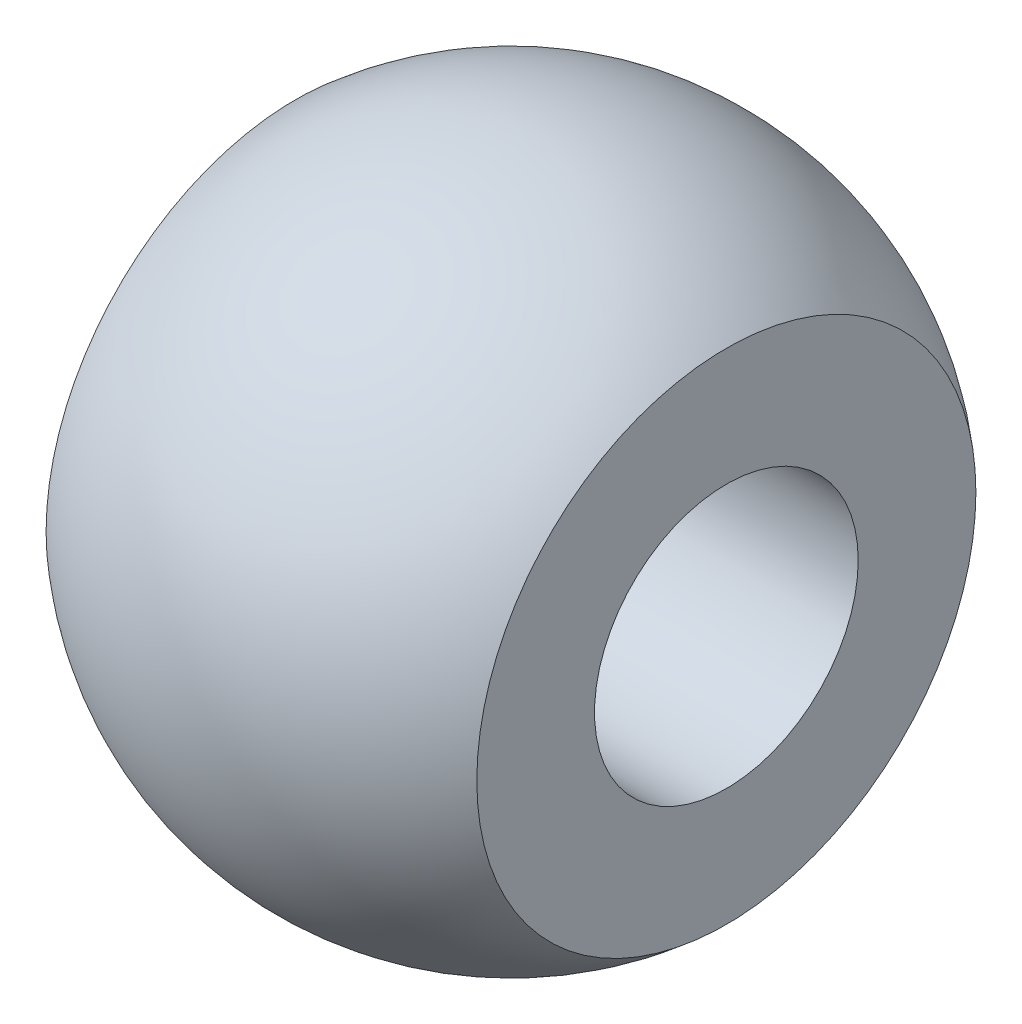
from build123d import *

# Parameters (mm, degrees)
CUT_EXTRUDE1_DEPTH      = 7.495190528
CUT_EXTRUDE1_DEPTH_BACK = 7.495190528
SKETCH5_W               = 4.58208324
SKETCH5_H               = 10.159370079
SKETCH5_W_2             = 3.58687964
SKETCH6_R               = 1.5
CUT_EXTRUDE2_DEPTH      = 4.9


with BuildPart() as part:
    # Sketch4 → Revolve1 (revolve)
    with BuildSketch(Plane(origin=(0, 0, 0), x_dir=(0, 0, -1), z_dir=(1, 0, 0))):
        with BuildLine():
            Line((-3.426947131, 1.522673098), (3.426947131, -1.522673098))
            ThreePointArc((3.426947131, -1.522673098), (-1.522673098, -3.426947131), (-3.426947131, 1.522673098))
        make_face()
    revolve(axis=Axis((0, 1.522673098, 3.426947131), (0, -0.40604615955398826, -0.9138525681484171)))

    # Sketch5 → Cut-Extrude1 (cut, two sides: drawn at the far end of the back side and taken through both)
    with BuildSketch(Plane(origin=(0, 0, 0), x_dir=(1, 0, 0), z_dir=(0, 1, 0)).offset(-CUT_EXTRUDE1_DEPTH_BACK)):
        with Locations((-4.74104162, -0.093300338)):
            Rectangle(SKETCH5_W, SKETCH5_H)
        with Locations((4.24343982, -0.093300338)):
            Rectangle(SKETCH5_W_2, SKETCH5_H)
    extrude(amount=CUT_EXTRUDE1_DEPTH + CUT_EXTRUDE1_DEPTH_BACK, mode=Mode.SUBTRACT)

    # Sketch6 → Cut-Extrude2 (cut)
    with BuildSketch(Plane(origin=(2.45, 0, 0), x_dir=(0, 0, -1), z_dir=(1, 0, 0))):
        Circle(SKETCH6_R)
    extrude(amount=-CUT_EXTRUDE2_DEPTH, mode=Mode.SUBTRACT)


solid = part.part
